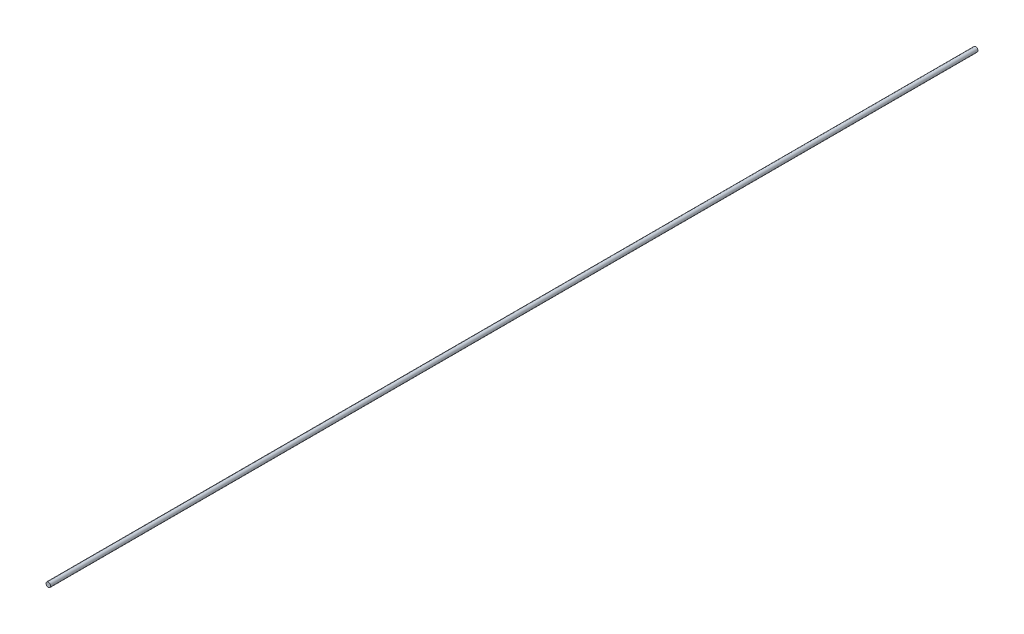
from build123d import *

# Parameters (mm, degrees)
SKETCH_1_R      = 0.5
EXTRUDE_1_DEPTH = 200


with BuildPart() as part:
    # Эскиз1 → Бобышка-Вытянуть1 (new body)
    with BuildSketch(Plane.XY):
        Circle(SKETCH_1_R)
    extrude(amount=EXTRUDE_1_DEPTH)


solid = part.part
